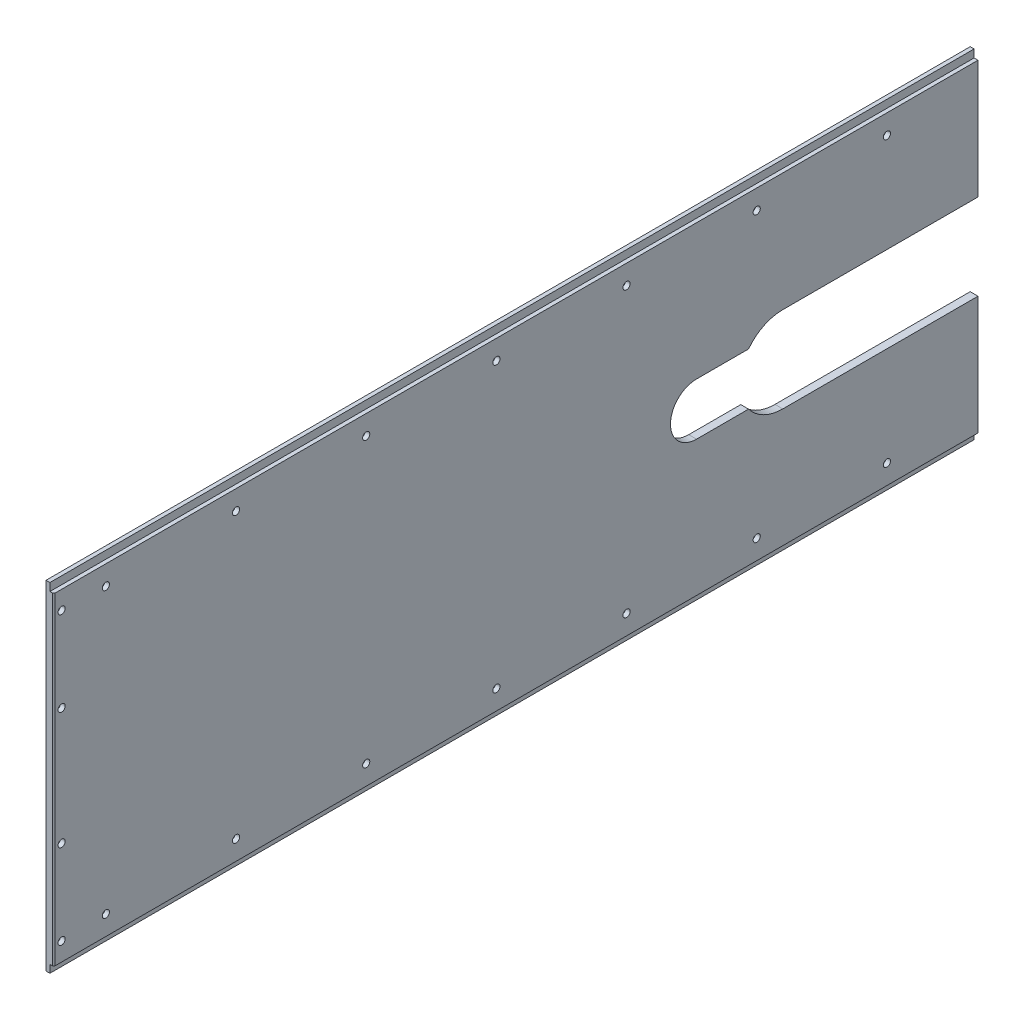
from build123d import *

# Parameters (mm, degrees)
BOSS_EXTRUDE1_DEPTH                                  = 6
SKIZZE1_W                                            = 3
SKIZZE1_H                                            = 6
SCHNITT_LINEAR_AUSTRAGEN1_DEPTH                      = 722.828234416
FORMSENKUNG_FUR_M5_LINSENSENKSCHRAUBE_MI_D           = 5.5
FORMSENKUNG_FUR_M5_LINSENSENKSCHRAUBE_MI_CSINK_D     = 10.4
FORMSENKUNG_FUR_M5_LINSENSENKSCHRAUBE_MI_CSINK_ANGLE = 90
CHAMFER1_SIZE                                        = 1
CSK_FOR_M5_COUNTERSUNK_RAISED_HEAD_SCREW_D           = 5.5
CSK_FOR_M5_COUNTERSUNK_RAISED_HEAD_SCREW_CSINK_D     = 10.4
CSK_FOR_M5_COUNTERSUNK_RAISED_HEAD_SCREW_CSINK_ANGLE = 90
LPATTERN1_COUNT                                      = 7
LPATTERN1_PITCH                                      = 100
SPIEGELN1_COPY_1_D                                   = 5.5
SPIEGELN1_COPY_1_CSINK_D                             = 10.4
SPIEGELN1_COPY_1_CSINK_ANGLE                         = 90
SPIEGELN1_COPY_2_D                                   = 5.5
SPIEGELN1_COPY_2_CSINK_D                             = 10.4
SPIEGELN1_COPY_2_CSINK_ANGLE                         = 90
SPIEGELN1_COPY_3_D                                   = 5.5
SPIEGELN1_COPY_3_CSINK_D                             = 10.4
SPIEGELN1_COPY_3_CSINK_ANGLE                         = 90
SPIEGELN1_COPY_4_D                                   = 5.5
SPIEGELN1_COPY_4_CSINK_D                             = 10.4
SPIEGELN1_COPY_4_CSINK_ANGLE                         = 90
SPIEGELN1_COPY_5_D                                   = 5.5
SPIEGELN1_COPY_5_CSINK_D                             = 10.4
SPIEGELN1_COPY_5_CSINK_ANGLE                         = 90
SPIEGELN1_COPY_6_D                                   = 5.5
SPIEGELN1_COPY_6_CSINK_D                             = 10.4
SPIEGELN1_COPY_6_CSINK_ANGLE                         = 90


with BuildPart() as part:
    # Sketch1 → Boss-Extrude1 (new body)
    with BuildSketch(Plane(origin=(0, 0, 0), x_dir=(0, 0, -1), z_dir=(1, 0, 0))):
        with BuildLine():
            Line((-355, 130), (355, 130))
            Line((355, 130), (355, 33))
            Line((355, 33), (205, 33))
            ThreePointArc((205, 33), (190.354181484, 29.571946165), (178.751190503, 20))
            Line((178.751190503, 20), (138.751190503, 20))
            ThreePointArc((138.751190503, 20), (118.751190503, 0), (138.751190503, -20))
            Line((138.751190503, -20), (178.751190503, -20))
            ThreePointArc((178.751190503, -20), (190.354181484, -29.571946165), (205, -33))
            Line((205, -33), (355, -33))
            Line((355, -33), (355, -130))
            Line((355, -130), (-355, -130))
            Line((-355, -130), (-355, 130))
        make_face()
    extrude(amount=BOSS_EXTRUDE1_DEPTH)

    # Skizze1 → Schnitt-Linear austragen1 (cut, through all)
    with BuildSketch(Plane.XY.offset(355)):
        with Locations((4.5, -127)):
            Rectangle(SKIZZE1_W, SKIZZE1_H)
        with Locations((4.5, 127)):
            Rectangle(SKIZZE1_W, SKIZZE1_H)
    extrude(amount=-SCHNITT_LINEAR_AUSTRAGEN1_DEPTH, mode=Mode.SUBTRACT)

    # Formsenkung fur M5 Linsensenkschraube mit Schlitz1 (through all)
    with Locations(Plane.ZY):
        with Locations((349, -110), (349, -45)):
            formsenkung_fur_m5_linsensenkschraube_mi = CounterSinkHole(FORMSENKUNG_FUR_M5_LINSENSENKSCHRAUBE_MI_D / 2, FORMSENKUNG_FUR_M5_LINSENSENKSCHRAUBE_MI_CSINK_D / 2, counter_sink_angle=FORMSENKUNG_FUR_M5_LINSENSENKSCHRAUBE_MI_CSINK_ANGLE)

    # Chamfer1
    chamfer1_edges = [part.edges().sort_by_distance(p)[0] for p in [
        (6, 0, 355),
    ]]
    chamfer(chamfer1_edges, length=CHAMFER1_SIZE)

    # CSK for M5 Countersunk Raised Head Screw1 (through all)
    with Locations(Plane.ZY):
        with Locations((315, -109)):
            csk_for_m5_countersunk_raised_head_screw = CounterSinkHole(CSK_FOR_M5_COUNTERSUNK_RAISED_HEAD_SCREW_D / 2, CSK_FOR_M5_COUNTERSUNK_RAISED_HEAD_SCREW_CSINK_D / 2, counter_sink_angle=CSK_FOR_M5_COUNTERSUNK_RAISED_HEAD_SCREW_CSINK_ANGLE)

    # LPattern1: CSK for M5 Countersunk Raised Head Screw1 ×7
    with Locations(*[(0, 0, -i * LPATTERN1_PITCH) for i in range(1, LPATTERN1_COUNT)]):
        add(csk_for_m5_countersunk_raised_head_screw, mode=Mode.SUBTRACT)

    # Spiegeln1: Formsenkung fur M5 Linsensenkschraube mit Schlitz1, CSK for M5 Countersunk Raised Head Screw1 across plane
    add(formsenkung_fur_m5_linsensenkschraube_mi.mirror(Plane.ZX), mode=Mode.SUBTRACT)
    add(csk_for_m5_countersunk_raised_head_screw.mirror(Plane.ZX), mode=Mode.SUBTRACT)

    # Spiegeln1 copy 1 (through all)
    with Locations(Plane(origin=(0, 0, -100), x_dir=(0, 0, 1), z_dir=(-1, 0, 0))):
        with Locations((315, 109)):
            CounterSinkHole(SPIEGELN1_COPY_1_D / 2, SPIEGELN1_COPY_1_CSINK_D / 2, counter_sink_angle=SPIEGELN1_COPY_1_CSINK_ANGLE)

    # Spiegeln1 copy 2 (through all)
    with Locations(Plane(origin=(0, 0, -200), x_dir=(0, 0, 1), z_dir=(-1, 0, 0))):
        with Locations((315, 109)):
            CounterSinkHole(SPIEGELN1_COPY_2_D / 2, SPIEGELN1_COPY_2_CSINK_D / 2, counter_sink_angle=SPIEGELN1_COPY_2_CSINK_ANGLE)

    # Spiegeln1 copy 3 (through all)
    with Locations(Plane(origin=(0, 0, -300), x_dir=(0, 0, 1), z_dir=(-1, 0, 0))):
        with Locations((315, 109)):
            CounterSinkHole(SPIEGELN1_COPY_3_D / 2, SPIEGELN1_COPY_3_CSINK_D / 2, counter_sink_angle=SPIEGELN1_COPY_3_CSINK_ANGLE)

    # Spiegeln1 copy 4 (through all)
    with Locations(Plane(origin=(0, 0, -400), x_dir=(0, 0, 1), z_dir=(-1, 0, 0))):
        with Locations((315, 109)):
            CounterSinkHole(SPIEGELN1_COPY_4_D / 2, SPIEGELN1_COPY_4_CSINK_D / 2, counter_sink_angle=SPIEGELN1_COPY_4_CSINK_ANGLE)

    # Spiegeln1 copy 5 (through all)
    with Locations(Plane(origin=(0, 0, -500), x_dir=(0, 0, 1), z_dir=(-1, 0, 0))):
        with Locations((315, 109)):
            CounterSinkHole(SPIEGELN1_COPY_5_D / 2, SPIEGELN1_COPY_5_CSINK_D / 2, counter_sink_angle=SPIEGELN1_COPY_5_CSINK_ANGLE)

    # Spiegeln1 copy 6 (through all)
    with Locations(Plane(origin=(0, 0, -600), x_dir=(0, 0, 1), z_dir=(-1, 0, 0))):
        with Locations((315, 109)):
            CounterSinkHole(SPIEGELN1_COPY_6_D / 2, SPIEGELN1_COPY_6_CSINK_D / 2, counter_sink_angle=SPIEGELN1_COPY_6_CSINK_ANGLE)


solid = part.part
